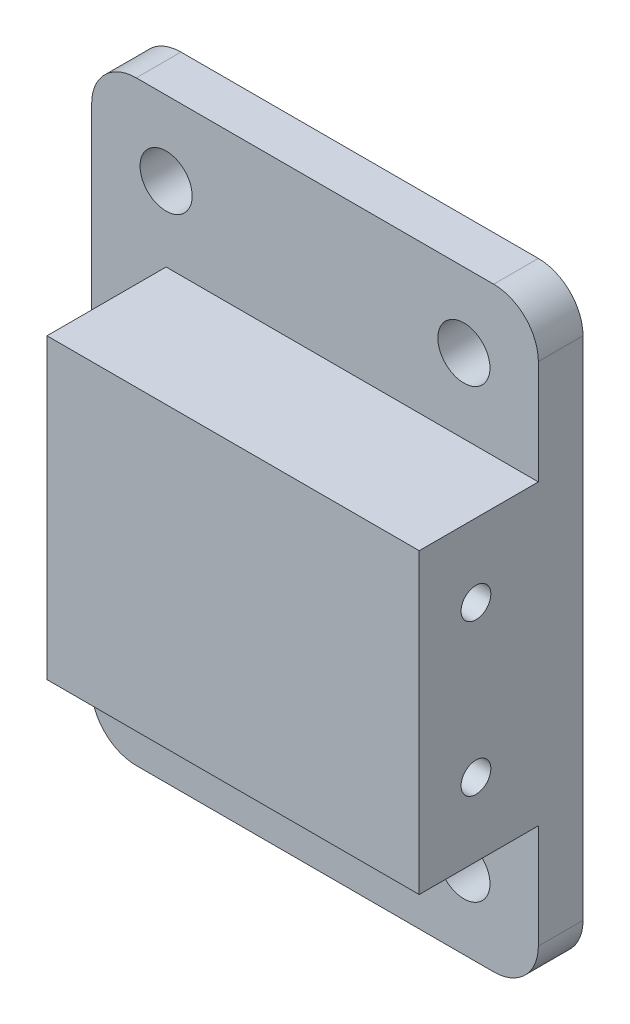
from build123d import *

# Parameters (mm, degrees)
SKETCH_1_W              = 30
SKETCH_1_H              = 40
EXTRUDE_1_DEPTH         = 1.5
SKETCH_2_W              = 25
SKETCH_2_H              = 20
EXTRUDE_2_DEPTH         = 8
HOLE_WIZARD_2_0_2_3_D   = 2
HOLE_WIZARD_3_5_3_5_1_D = 3.5
FILLET_1_R              = 3


with BuildPart() as part:
    # 草圖1 → 填料-伸長1 (new, symmetric)
    with BuildSketch(Plane.XY):
        Rectangle(SKETCH_1_W, SKETCH_1_H)
    extrude(amount=EXTRUDE_1_DEPTH, both=True)

    # 草圖2 → 填料-伸長2 (add)
    with BuildSketch(Plane.XY.offset(1.5)):
        with Locations((2.5, 0)):
            Rectangle(SKETCH_2_W, SKETCH_2_H)
    extrude(amount=EXTRUDE_2_DEPTH)

    # Ø2.0 (2) 直徑孔3 (through all)
    with Locations(Plane.ZY.offset(10)):
        with Locations((5.69, 5.08), (5.69, -5.08)):
            Hole(HOLE_WIZARD_2_0_2_3_D / 2)

    # Ø3.5 (3.5) 直徑孔1 (through all)
    with Locations(Plane.XY.offset(1.5)):
        with Locations((10, 15), (-10, -15), (-10, 15), (10, -15)):
            Hole(HOLE_WIZARD_3_5_3_5_1_D / 2)

    # 圓角1
    fillet_1_edges = [part.edges().sort_by_distance(p)[0] for p in [
        (15, -20, 0),
        (-15, -20, 0),
        (-15, 20, 0),
        (15, 20, 0),
    ]]
    fillet(fillet_1_edges, radius=FILLET_1_R)


solid = part.part
